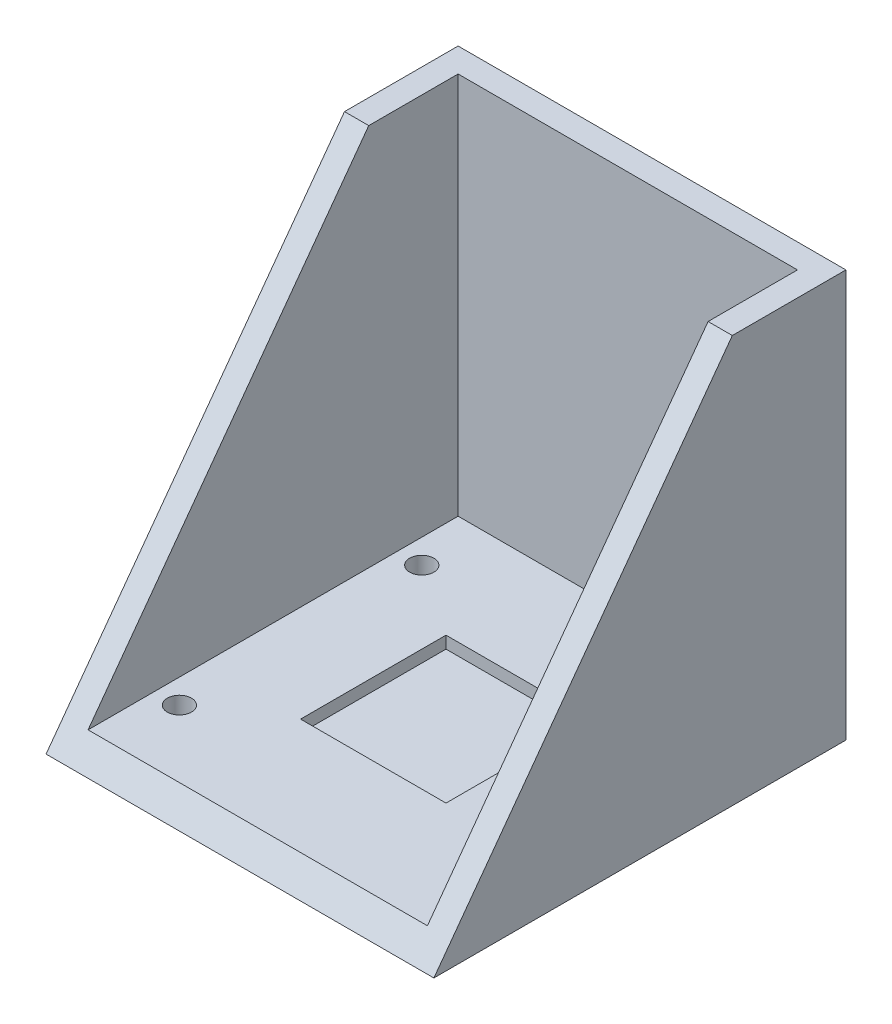
from build123d import *

# Parameters (mm, degrees)
SKETCH1_W           = 203.2
SKETCH1_H           = 215.9
BOSS_EXTRUDE1_DEPTH = 213.36
SHELL2_T            = -12.7
SKETCH2_W           = 76.2
SKETCH2_H           = 76.2
CUT_EXTRUDE1_DEPTH  = 6.35
SKETCH3_R           = 6.35
CUT_EXTRUDE2_DEPTH  = 250.479855099
CUT_EXTRUDE3_DEPTH  = 314.792817158


with BuildPart() as part:
    # Sketch1 → Boss-Extrude1 (new body)
    with BuildSketch(Plane(origin=(0, 0, 0), x_dir=(1, 0, 0), z_dir=(0, 1, 0))):
        Rectangle(SKETCH1_W, SKETCH1_H)
    extrude(amount=BOSS_EXTRUDE1_DEPTH)

    # Shell2
    shell2_openings = [part.faces().sort_by_distance(p)[0] for p in [
        (0, 213.36, 0),
        (0, 106.68, 107.95),
    ]]
    offset(amount=SHELL2_T, openings=shell2_openings, kind=Kind.INTERSECTION)

    # Sketch2 → Cut-Extrude1 (cut)
    with BuildSketch(Plane(origin=(0, 12.7, 0), x_dir=(1, 0, 0), z_dir=(0, 1, 0))):
        Rectangle(SKETCH2_W, SKETCH2_H)
    extrude(amount=-CUT_EXTRUDE1_DEPTH, mode=Mode.SUBTRACT)

    # Sketch3 → Cut-Extrude2 (cut, through all)
    with BuildSketch(Plane(origin=(0, 12.7, 0), x_dir=(1, 0, 0), z_dir=(0, 1, 0))):
        with Locations(Location((-76.2, 63.5, 0), (0, 0, 270))):
            Circle(SKETCH3_R)
        with Locations(Location((-76.2, -63.5, 0), (0, 0, 270))):
            Circle(SKETCH3_R)
        with Locations(Location((76.2, 63.5, 0), (0, 0, 270))):
            Circle(SKETCH3_R)
        with Locations(Location((76.2, -63.5, 0), (0, 0, 270))):
            Circle(SKETCH3_R)
    extrude(amount=-CUT_EXTRUDE2_DEPTH, mode=Mode.SUBTRACT)

    # Sketch4 → Cut-Extrude3 (cut, through all)
    with BuildSketch(Plane(origin=(101.6, 0, 0), x_dir=(0, 0, -1), z_dir=(1, 0, 0))):
        Polygon((48.42184808, 213.36), (-107.95, 0), (-107.95, 213.36), align=None)
    extrude(amount=-CUT_EXTRUDE3_DEPTH, mode=Mode.SUBTRACT)


solid = part.part
